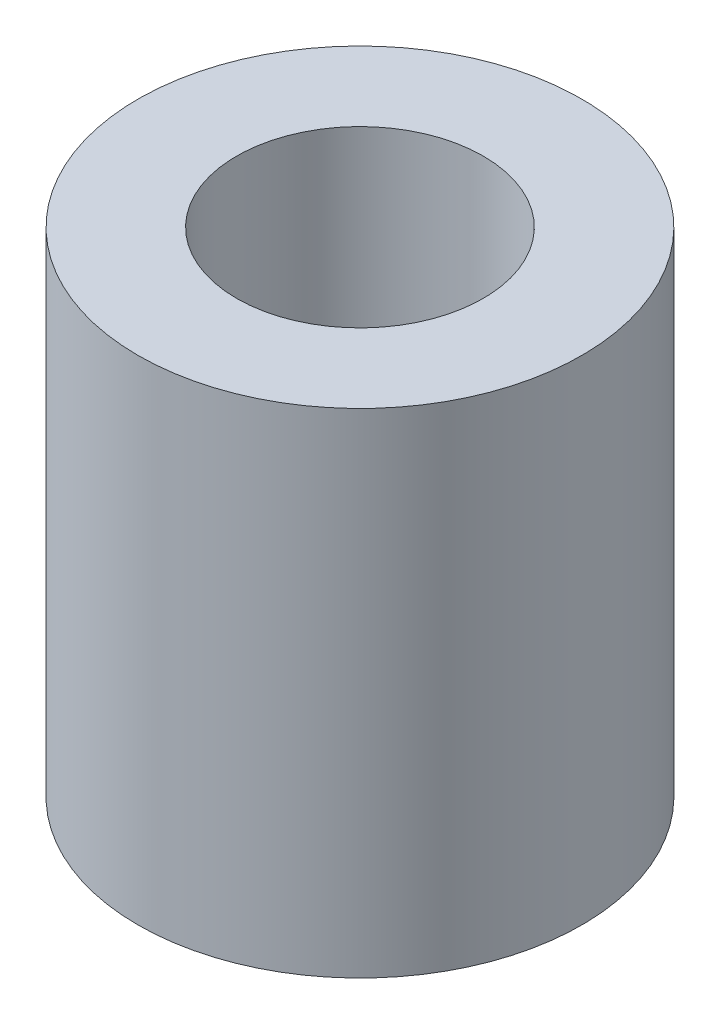
from build123d import *

# Parameters (mm, degrees)
SKETCH1_R           = 4.5
BOSS_EXTRUDE1_DEPTH = 10
SKETCH2_R           = 2.5
CUT_EXTRUDE1_DEPTH  = 12.853269591


with BuildPart() as part:
    # Sketch1 → Boss-Extrude1 (new body)
    with BuildSketch(Plane(origin=(0, 0, 0), x_dir=(1, 0, 0), z_dir=(0, 1, 0))):
        with Locations(Location((0, 0, 0), (0, 0, 270))):
            Circle(SKETCH1_R)
    extrude(amount=BOSS_EXTRUDE1_DEPTH)

    # Sketch2 → Cut-Extrude1 (cut, through all)
    with BuildSketch(Plane(origin=(0, 10, 0), x_dir=(1, 0, 0), z_dir=(0, 1, 0))):
        with Locations(Location((0, 0, 0), (0, 0, 270))):
            Circle(SKETCH2_R)
    extrude(amount=-CUT_EXTRUDE1_DEPTH, mode=Mode.SUBTRACT)


solid = part.part
